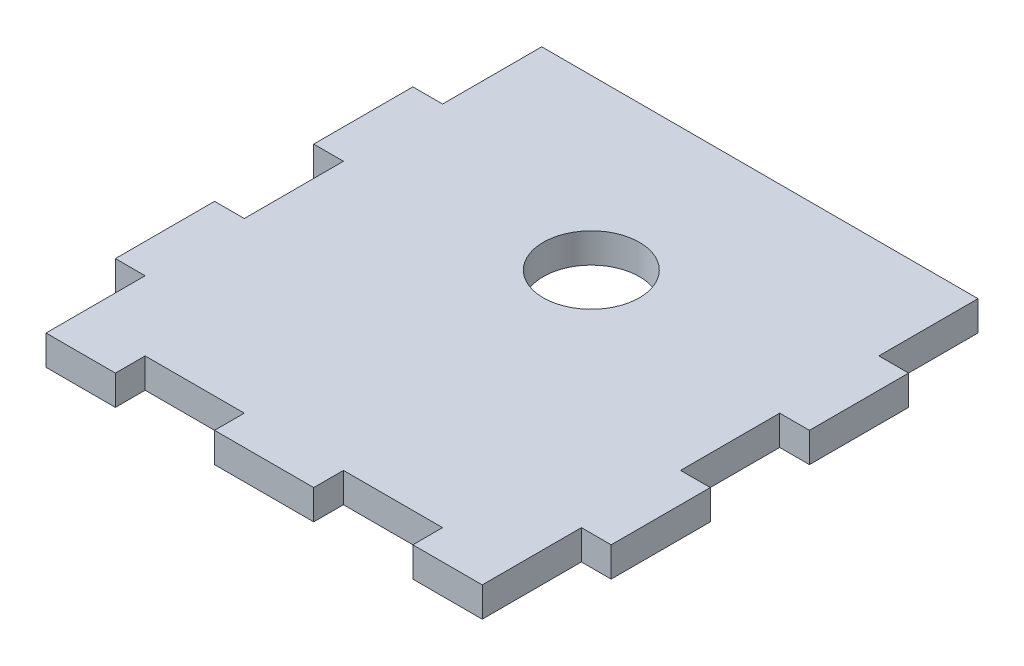
from build123d import *

# Parameters (mm, degrees)
CROQUIS1_R              = 4.85
SALIENTE_EXTRUIR1_DEPTH = 3


with BuildPart() as part:
    # Croquis1 → Saliente-Extruir1 (new body)
    with BuildSketch(Plane(origin=(0, 0, 0), x_dir=(1, 0, 0), z_dir=(0, 1, 0))):
        Polygon((3, 10), (3, 0), (10, 0), (10, 3), (20, 3), (20, 0), (25, 0), (30, 0), (30, 3), (40, 3), (40, 0), (47, 0), (47, 10), (50, 10), (50, 20), (47, 20), (47, 30), (50, 30), (50, 40), (47, 40), (47, 50), (3, 50), (3, 40), (0, 40), (0, 30), (3, 30), (3, 20), (0, 20), (0, 10), align=None)
        with Locations(Location((25, 33, 0), (0, 0, 270))):
            Circle(CROQUIS1_R, mode=Mode.SUBTRACT)
    extrude(amount=SALIENTE_EXTRUIR1_DEPTH)


solid = part.part
